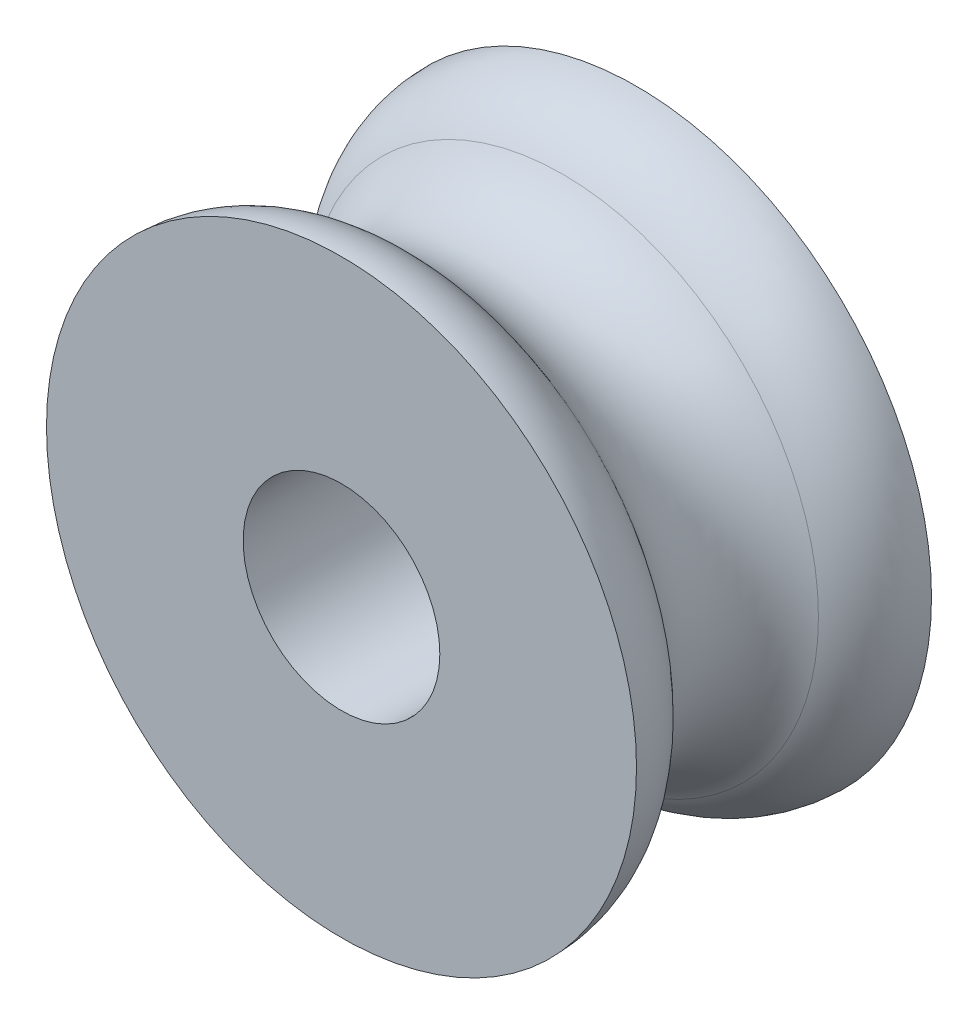
from build123d import *


with BuildPart() as part:
    # Sketch1 → Revolve1 (revolve)
    with BuildSketch(Plane(origin=(0, 0, 0), x_dir=(0, 0, -1), z_dir=(1, 0, 0)), mode=Mode.PRIVATE) as revolve1_sk:
        with BuildLine():
            Line((-3, 2), (3, 2))
            Line((3, 2), (3, 6))
            ThreePointArc((3, 6), (2.15, 5.7875), (1.5, 5.2))
            ThreePointArc((1.5, 5.2), (0, 4.4), (-1.5, 5.2))
            ThreePointArc((-1.5, 5.2), (-2.15, 5.7875), (-3, 6))
            Line((-3, 6), (-3, 2))
        make_face()
    revolve(revolve1_sk.sketch.rotate(Axis((0, 0, 0), (0, 0, -1)), 90), axis=Axis((0, 0, 0), (0, 0, -1)))


solid = part.part
